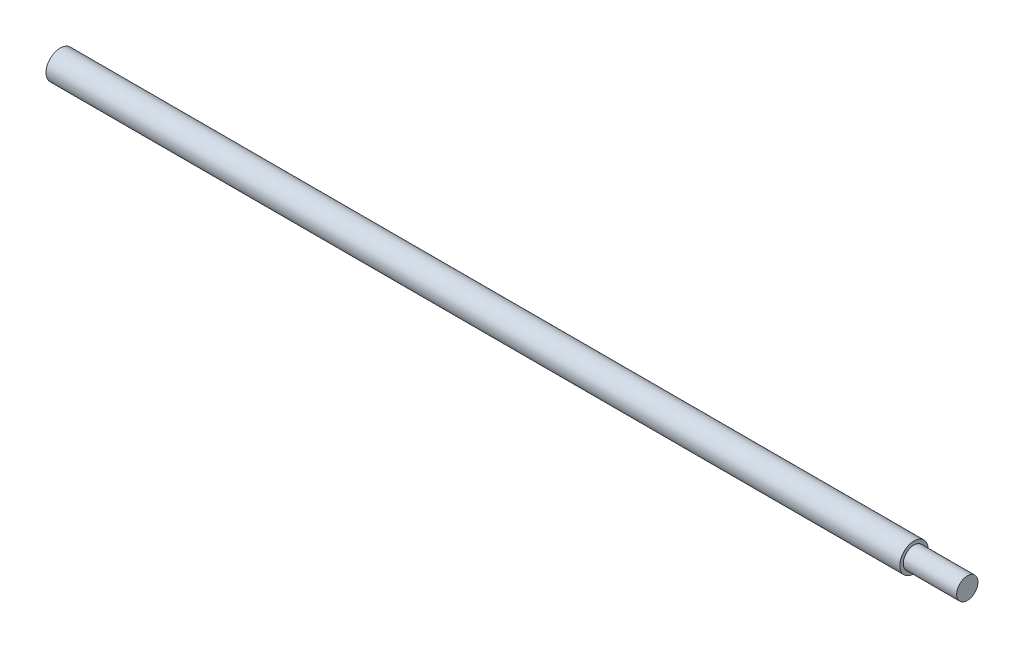
from build123d import *


with BuildPart() as part:
    # Sketch1 → Revolve1 (revolve)
    with BuildSketch(Plane.XY, mode=Mode.PRIVATE) as revolve1_sk:
        Polygon((-127.5, 0), (-127.5, 4), (112.5, 4), (112.5, 3), (127.5, 3), (127.5, 0), align=None)
    revolve(revolve1_sk.sketch.rotate(Axis((277.081919691, 0, 0), (-1, 0, 0)), 90), axis=Axis((277.081919691, 0, 0), (-1, 0, 0)))


solid = part.part
